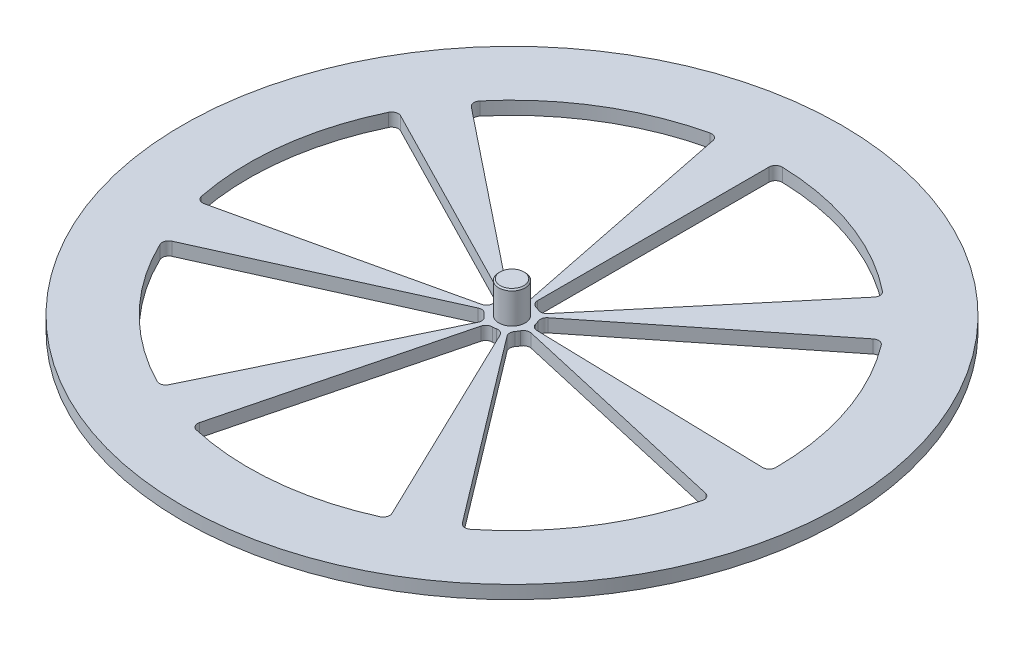
from build123d import *

# Parameters (mm, degrees)
SKETCH1_R                = 250
BOSS_EXTRUDE1_DEPTH      = 10
CUT_EXTRUDE1_DEPTH       = 354.694783677
FILLET1_R                = 5
CIRPATTERN1_COUNT        = 7
FILLET1_OF_CIRPATTERN1_R = 5
SKETCH3_R                = 10
BOSS_EXTRUDE2_DEPTH      = 24.1
CHAMFER1_SIZE            = 1


with BuildPart() as part:
    # Sketch1 → Boss-Extrude1 (new body)
    with BuildSketch(Plane(origin=(0, 0, 0), x_dir=(1, 0, 0), z_dir=(0, 1, 0))):
        with Locations(Location((0, 0, 0), (0, 0, 270))):
            Circle(SKETCH1_R)
    extrude(amount=BOSS_EXTRUDE1_DEPTH)

    # Sketch2 → Cut-Extrude1 (cut, through all)
    with BuildSketch(Plane(origin=(0, 10, 0), x_dir=(1, 0, 0), z_dir=(0, 1, 0))):
        with BuildLine():
            Line((0, 15), (0, 200))
            ThreePointArc((0, 200), (68.404028665, 187.938524157), (128.557521937, 153.208888624))
            Line((128.557521937, 153.208888624), (9.641814145, 11.490666647))
            ThreePointArc((9.641814145, 11.490666647), (5.13030215, 14.095389312), (0, 15))
        make_face()
    cut_extrude1 = extrude(amount=-CUT_EXTRUDE1_DEPTH, mode=Mode.SUBTRACT)

    # Fillet1
    fillet1_edges = [part.edges().sort_by_distance(p)[0] for p in [
        (9.641814145, 5, -11.490666647),
        (0, 5, -15),
        (0, 5, -200),
        (128.557521937, 5, -153.208888624),
    ]]
    fillet(fillet1_edges, radius=FILLET1_R)

    # CirPattern1: Cut-Extrude1 ×7 about axis
    cirpattern1_axis = Axis((0, 0, 0), (0, 1, 0))
    for i in range(1, CIRPATTERN1_COUNT):
        add(cut_extrude1.rotate(cirpattern1_axis, i * 360 / CIRPATTERN1_COUNT), mode=Mode.SUBTRACT)

    # Fillet1 of CirPattern1
    fillet1_of_cirpattern1_edges = [part.edges().sort_by_distance(p)[0] for p in [
        (-2.972192148, 5, -14.702587318),
        (-11.727472237, 5, -9.352347028),
        (-156.366296494, 5, -124.697960372),
        (-39.62922864, 5, -196.03449757),
        (-13.348077132, 5, -6.84315986),
        (-14.623918683, 5, 3.337814009),
        (-194.985582436, 5, 44.504186791),
        (-177.974361762, 5, -91.242131471),
        (-13.672587785, 5, 6.169306547),
        (-6.508256087, 5, 13.514533019),
        (-86.776747824, 5, 180.19377358),
        (-182.301170462, 5, 82.257420626),
        (-3.701360965, 5, 14.536159293),
        (6.508256087, 5, 13.514533019),
        (86.776747824, 5, 180.19377358),
        (-49.351479538, 5, 193.815457246),
        (9.057066155, 5, 11.956987608),
        (14.623918683, 5, 3.337814009),
        (194.985582436, 5, 44.504186791),
        (120.760882065, 5, 159.426501445),
        (14.99533773, 5, 0.373960376),
        (11.727472237, 5, -9.352347028),
        (156.366296494, 5, -124.697960372),
        (199.9378364, 5, 4.986138348),
    ]]
    fillet(fillet1_of_cirpattern1_edges, radius=FILLET1_OF_CIRPATTERN1_R)

    # Sketch3 → Boss-Extrude2 (add)
    with BuildSketch(Plane(origin=(0, 10, 0), x_dir=(1, 0, 0), z_dir=(0, 1, 0))):
        with Locations(Location((0, 0, 0), (0, 0, 270))):
            Circle(SKETCH3_R)
    extrude(amount=BOSS_EXTRUDE2_DEPTH)

    # Chamfer1
    chamfer1_edges = [part.edges().sort_by_distance(p)[0] for p in [
        (0, 34.1, -10),
    ]]
    chamfer(chamfer1_edges, length=CHAMFER1_SIZE)


solid = part.part
